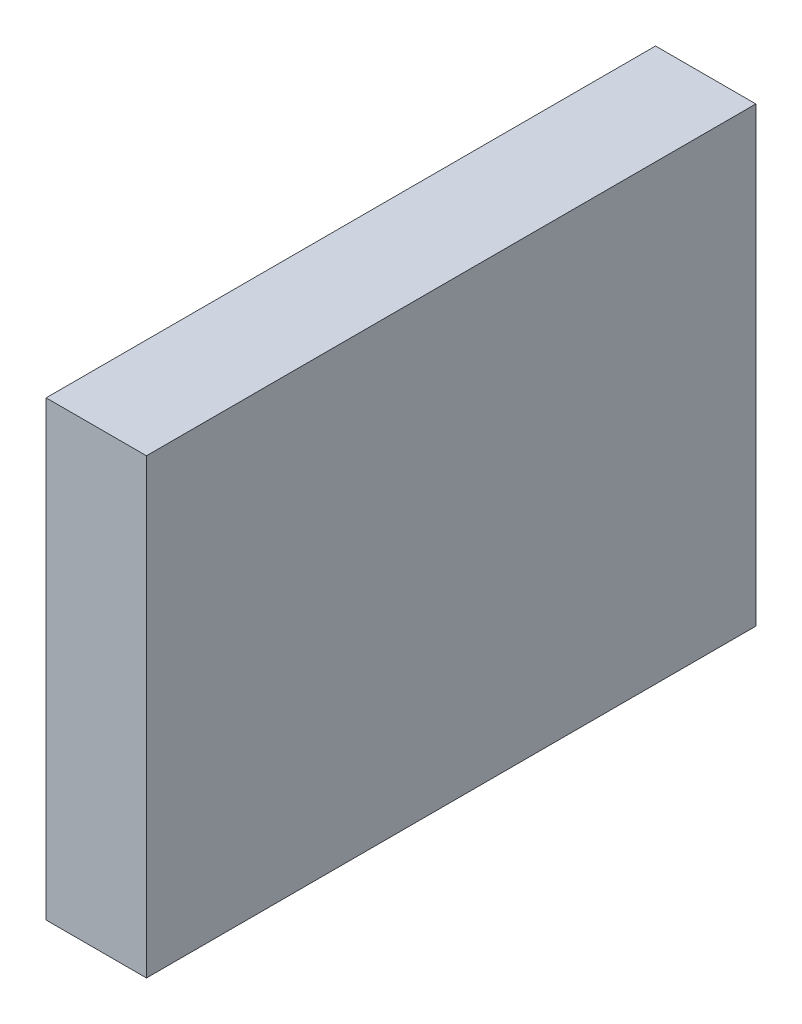
from build123d import *

# Parameters (mm, degrees)
CROQUIS1_W              = 230.805004707
CROQUIS1_H              = 171.294306629
SALIENTE_EXTRUIR1_DEPTH = 38


with BuildPart() as part:
    # Croquis1 → Saliente-Extruir1 (new body)
    with BuildSketch(Plane(origin=(0, 0, 0), x_dir=(0, 0, -1), z_dir=(1, 0, 0))):
        with Locations((-69.965280173, 41.617278724)):
            Rectangle(CROQUIS1_W, CROQUIS1_H)
    extrude(amount=SALIENTE_EXTRUIR1_DEPTH)


solid = part.part
